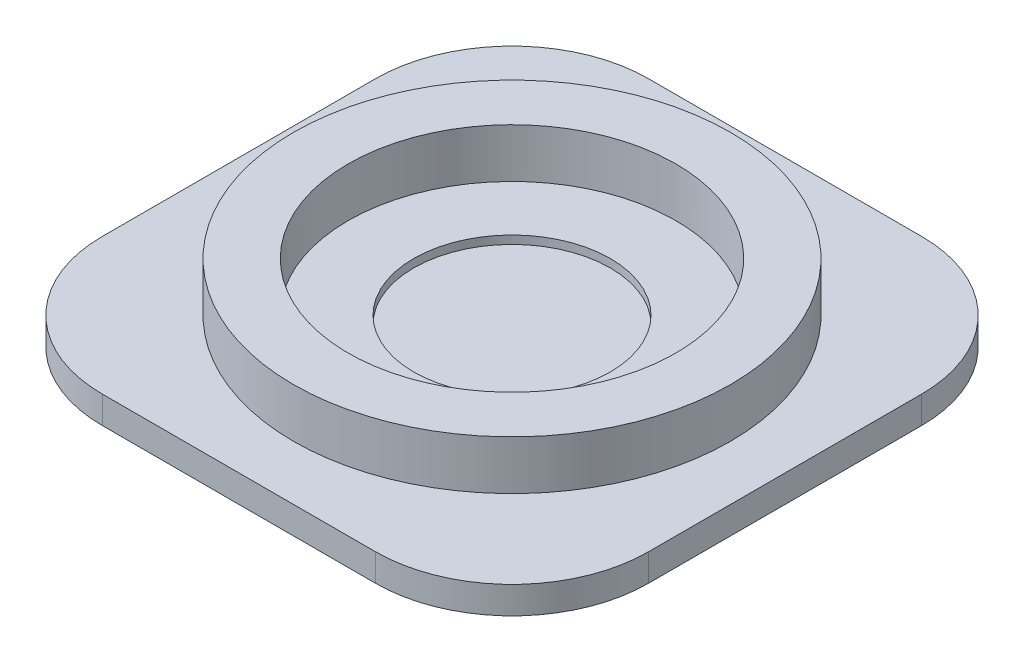
from build123d import *

# Parameters (mm, degrees)
RESSALTO_EXTRUS_O1_DEPTH = 5
ESBO_O2_R                = 40
ESBO_O2_R_2              = 30
EXTRUS_O_FINA1_DEPTH     = 18
ESBO_O7_R                = 18
CORTE_EXTRUS_O2_DEPTH    = 1.5
CORTE_EXTRUS_O9_DEPTH    = 128.5


with BuildPart() as part:
    # Esboço1 → Ressalto-extrusão1 (new body)
    with BuildSketch(Plane(origin=(0, 0, 0), x_dir=(1, 0, 0), z_dir=(0, 1, 0))):
        with BuildLine():
            Line((-35.169337018, 43.205430296), (14.830662982, 43.205430296))
            ThreePointArc((14.830662982, 43.205430296), (32.508332512, 35.883099826), (39.830662982, 18.205430296))
            Line((39.830662982, 18.205430296), (39.830662982, -31.794569704))
            ThreePointArc((39.830662982, -31.794569704), (32.508332512, -49.472239233), (14.830662982, -56.794569704))
            Line((14.830662982, -56.794569704), (-35.169337018, -56.794569704))
            ThreePointArc((-35.169337018, -56.794569704), (-52.847006547, -49.472239233), (-60.169337018, -31.794569704))
            Line((-60.169337018, -31.794569704), (-60.169337018, 18.205430296))
            ThreePointArc((-60.169337018, 18.205430296), (-52.847006547, 35.883099826), (-35.169337018, 43.205430296))
        make_face()
    extrude(amount=RESSALTO_EXTRUS_O1_DEPTH)

    # Esboço2 → Extrusão-Fina1 (add)
    with BuildSketch(Plane(origin=(0, 5, 0), x_dir=(1, 0, 0), z_dir=(0, 1, 0))):
        with Locations((-10.169337018, -6.794569704)):
            Circle(ESBO_O2_R)
        with Locations((-10.169337018, -6.794569704)):
            Circle(ESBO_O2_R_2, mode=Mode.SUBTRACT)
    extrude(amount=EXTRUS_O_FINA1_DEPTH)

    # Esboço7 → Corte-extrusão2 (cut)
    with BuildSketch(Plane(origin=(0, 5, 0), x_dir=(1, 0, 0), z_dir=(0, 1, 0))):
        with Locations(Location((-10.169337018, -6.794569704, 0), (0, 0, 270))):
            Circle(ESBO_O7_R)
    extrude(amount=-CORTE_EXTRUS_O2_DEPTH, mode=Mode.SUBTRACT)

    # Esboço16 → Corte-extrusão9 (cut)
    with BuildSketch(Plane(origin=(0, 0, -43.205430296), x_dir=(-1, 0, 0), z_dir=(0, 0, -1))):
        Polygon((-29.830662982, 14), (64.710384206, 14), (64.710384206, 40.871723048), (-29.830662982, 40.871723048), (-67.520218161, 40.871723048), (-67.520218161, 14), align=None)
    extrude(amount=-CORTE_EXTRUS_O9_DEPTH, mode=Mode.SUBTRACT)


solid = part.part
